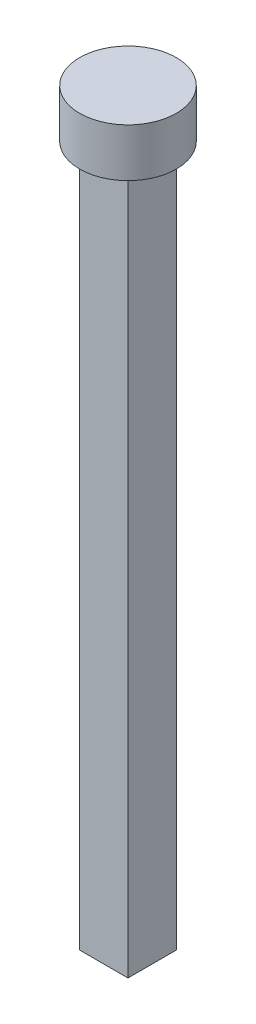
from build123d import *

# Parameters (mm, degrees)
SKETCH2_R           = 20
BOSS_EXTRUDE1_DEPTH = 20
SKETCH3_W           = 20
SKETCH3_H           = 20
BOSS_EXTRUDE2_DEPTH = 290
SKETCH4_R           = 5
CUT_EXTRUDE1_DEPTH  = 10


with BuildPart() as part:
    # Sketch2 → Boss-Extrude1 (new body)
    with BuildSketch(Plane(origin=(0, 0, 0), x_dir=(1, 0, 0), z_dir=(0, 1, 0))):
        with Locations(Location((0, 0, 0), (0, 0, 270))):
            Circle(SKETCH2_R)
    extrude(amount=BOSS_EXTRUDE1_DEPTH)

    # Sketch3 → Boss-Extrude2 (add)
    with BuildSketch(Plane.XZ):
        Rectangle(SKETCH3_W, SKETCH3_H)
    extrude(amount=BOSS_EXTRUDE2_DEPTH)

    # Sketch4 → Cut-Extrude1 (cut)
    with BuildSketch(Plane.XZ.offset(290)):
        with Locations(Location((0, 0, 0), (0, 0, 270))):
            Circle(SKETCH4_R)
    extrude(amount=-CUT_EXTRUDE1_DEPTH, mode=Mode.SUBTRACT)


solid = part.part
